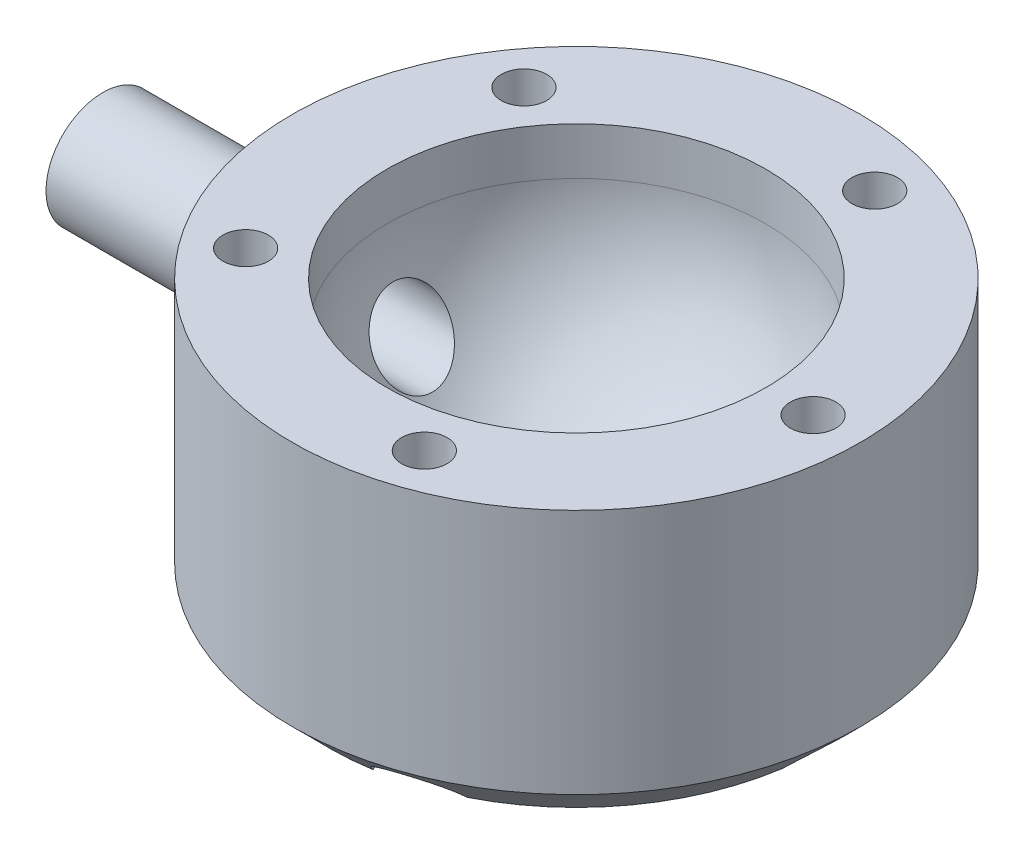
from build123d import *

# Parameters (mm, degrees)
BOSS_EXTRUDE1_REACH            = 92.554
BOSS_EXTRUDE1_END_RADIUS       = 30
SKETCH2_R                      = 6
CUT_EXTRUDE1_REACH             = 92.554
CUT_EXTRUDE1_END_RADIUS        = 20
SKETCH4_R                      = 4
CHAMFER1_SIZE                  = 4
CBORE_FOR_M4_SHCS1_D           = 4.8
CBORE_FOR_M4_SHCS1_CBORE_D     = 8
CBORE_FOR_M4_SHCS1_CBORE_DEPTH = 19


with BuildPart() as part:
    # Sketch1 → Revolve1 (revolve)
    with BuildSketch(Plane.XY, mode=Mode.PRIVATE) as revolve1_sk:
        with BuildLine():
            Line((20, 0), (20, -5))
            ThreePointArc((20, -5), (14.142135624, -19.142135624), (0, -25))
            Line((0, -25), (0, -30))
            Line((0, -30), (30, -30))
            Line((30, -30), (30, 0))
            Line((30, 0), (20, 0))
        make_face()
    revolve(revolve1_sk.sketch.rotate(Axis((0, 18.533057851, 0), (0, 1, 0)), 90), axis=Axis((0, 18.533057851, 0), (0, 1, 0)))

    # Boss-Extrude1: up to this cylinder (the profile starts outside it)
    boss_extrude1_end = Plane(origin=(0, -14, 0), z_dir=(0, -1, 0)) * Cylinder(BOSS_EXTRUDE1_END_RADIUS, 246.108, mode=Mode.PRIVATE)
    # Sketch2 → Boss-Extrude1 (add, up to the surface)
    with BuildSketch(Plane(origin=(-50, 0, 0), x_dir=(0, 0, -1), z_dir=(1, 0, 0)), mode=Mode.PRIVATE) as boss_extrude1_sk1:
        with Locations(Location((0, -14, 0), (0, 0, 180))):
            Circle(SKETCH2_R)
    boss_extrude1_tool1 = extrude(boss_extrude1_sk1.sketch, amount=BOSS_EXTRUDE1_REACH, mode=Mode.PRIVATE) - boss_extrude1_end
    add(boss_extrude1_tool1.solids().sort_by_distance((-50, -14, 0))[0])

    # Cut-Extrude1: up to this sphere (the profile starts outside it)
    cut_extrude1_end = Location((0, -5, 0)) * Sphere(CUT_EXTRUDE1_END_RADIUS, mode=Mode.PRIVATE)
    # Sketch4 → Cut-Extrude1 (cut, up to the surface)
    with BuildSketch(Plane.ZY.offset(50), mode=Mode.PRIVATE) as cut_extrude1_sk1:
        with Locations((0, -14)):
            Circle(SKETCH4_R)
    cut_extrude1_tool1 = extrude(cut_extrude1_sk1.sketch, amount=-CUT_EXTRUDE1_REACH, mode=Mode.PRIVATE) - cut_extrude1_end
    add(cut_extrude1_tool1.solids().sort_by_distance((-50, -14, 0))[0], mode=Mode.SUBTRACT)

    # Chamfer1
    chamfer1_edges = [part.edges().sort_by_distance(p)[0] for p in [
        (0, -30, 30),
    ]]
    chamfer(chamfer1_edges, length=CHAMFER1_SIZE)

    # CBORE for M4 SHCS1 (through all)
    with Locations(Plane(origin=(0, -30, 0), x_dir=(-1, 0, 0), z_dir=(0, -1, 0))):
        with Locations((-25, 0), (-7.725424859, -23.776412907), (20.225424859, -14.694631307), (20.225424859, 14.694631307), (-7.725424859, 23.776412907)):
            CounterBoreHole(CBORE_FOR_M4_SHCS1_D / 2, CBORE_FOR_M4_SHCS1_CBORE_D / 2, CBORE_FOR_M4_SHCS1_CBORE_DEPTH)


solid = part.part
